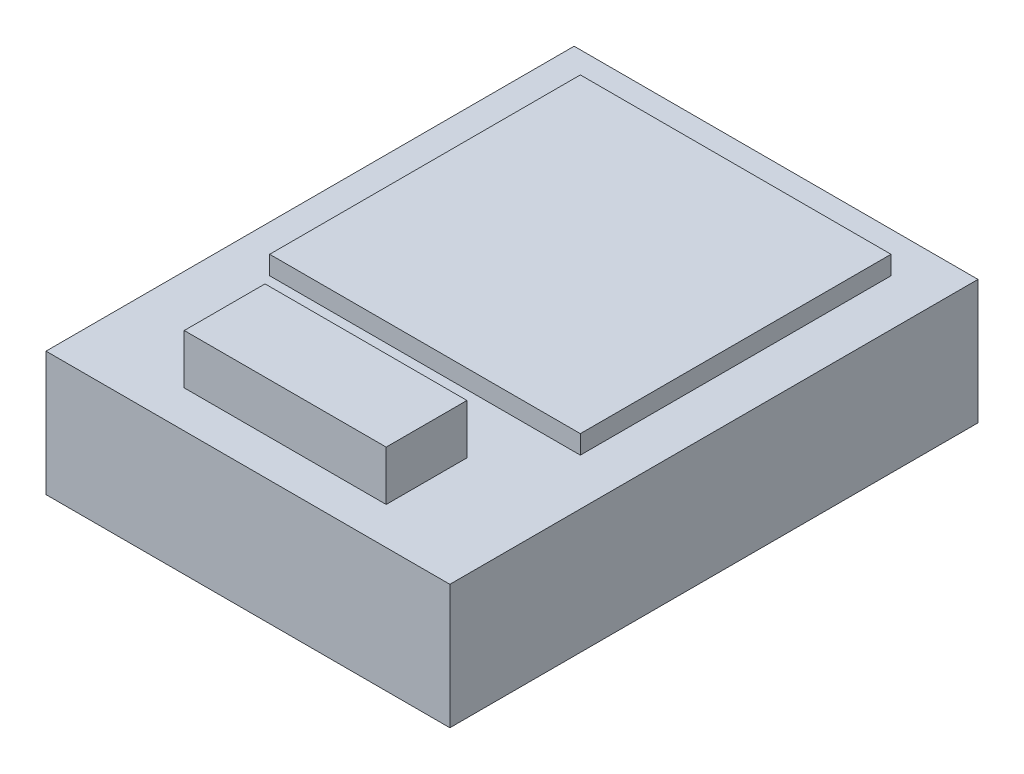
from build123d import *

# Parameters (mm, degrees)
SKETCH1_W           = 1.3
SKETCH1_H           = 1.7
BOSS_EXTRUDE1_DEPTH = 0.5
SKETCH2_W           = 1
SKETCH2_H           = 1
BOSS_EXTRUDE2_DEPTH = 0.06
SKETCH3_W           = 0.65
SKETCH3_H           = 0.26
BOSS_EXTRUDE3_DEPTH = 0.16
SKETCH4_W           = 2.706205425
SKETCH4_H           = 2.549362478
SKETCH4_W_2         = 0.4
SKETCH4_H_2         = 1.5
CUT_EXTRUDE1_DEPTH  = 0.1


with BuildPart() as part:
    # Sketch1 → Boss-Extrude1 (new body)
    with BuildSketch(Plane(origin=(0, 0, 0), x_dir=(1, 0, 0), z_dir=(0, 1, 0))):
        with Locations((0.231074169, 0.017774936)):
            Rectangle(SKETCH1_W, SKETCH1_H)
    extrude(amount=BOSS_EXTRUDE1_DEPTH)

    # Sketch2 → Boss-Extrude2 (add)
    with BuildSketch(Plane(origin=(0, 0.5, 0), x_dir=(1, 0, 0), z_dir=(0, 1, 0))):
        with Locations((0.231074169, 0.237774936)):
            Rectangle(SKETCH2_W, SKETCH2_H)
    extrude(amount=BOSS_EXTRUDE2_DEPTH)

    # Sketch3 → Boss-Extrude3 (add)
    with BuildSketch(Plane(origin=(0, 0.5, 0), x_dir=(1, 0, 0), z_dir=(0, 1, 0))):
        with Locations((0.231074169, -0.582225064)):
            Rectangle(SKETCH3_W, SKETCH3_H)
    extrude(amount=BOSS_EXTRUDE3_DEPTH)

    # Sketch4 → Cut-Extrude1 (cut)
    with BuildSketch(Plane.XZ):
        with Locations((0.454375992, -0.066954504)):
            Rectangle(SKETCH4_W, SKETCH4_H)
        with Locations((-0.093925831, -0.017774936)):
            Rectangle(SKETCH4_W_2, SKETCH4_H_2, mode=Mode.SUBTRACT)
        with Locations((0.556074169, -0.017774936)):
            Rectangle(SKETCH4_W_2, SKETCH4_H_2, mode=Mode.SUBTRACT)
    extrude(amount=-CUT_EXTRUDE1_DEPTH, mode=Mode.SUBTRACT)


solid = part.part
